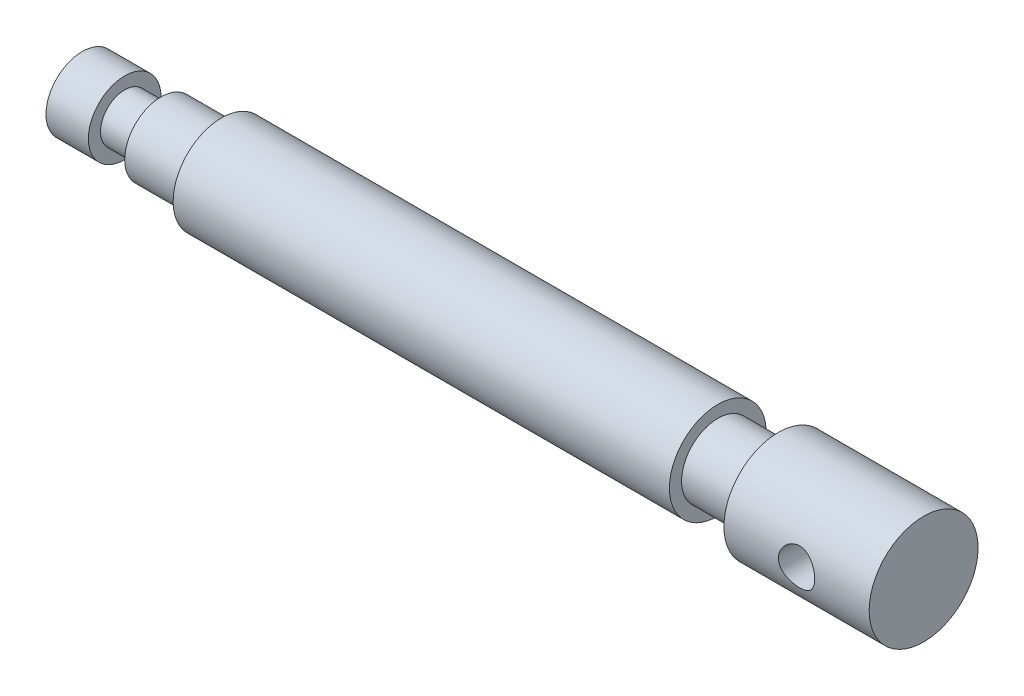
from build123d import *

# Parameters (mm, degrees)
CUT_EXTRUDE3_DEPTH      = 140.581517401
CUT_EXTRUDE3_DEPTH_BACK = 140.581517401
SKETCH2_R               = 3


with BuildPart() as part:
    # Sketch1 → Revolve1 (revolve)
    with BuildSketch(Plane.XY, mode=Mode.PRIVATE) as revolve1_sk:
        Polygon((0, 0), (0, 6), (7, 6), (7, 4), (13, 4), (13, 6), (23, 6), (23, 8), (105, 8), (105, 6), (115, 6), (115, 9), (139, 9), (139, 0), (124.407695479, 0), align=None)
    revolve(revolve1_sk.sketch.rotate(Axis((0, 0, 0), (1, 0, 0)), 90), axis=Axis((0, 0, 0), (1, 0, 0)))

    # Sketch2 → Cut-Extrude3 (cut, two sides: drawn at the far end of the back side and taken through both)
    with BuildSketch(Plane.XY.offset(-CUT_EXTRUDE3_DEPTH_BACK)):
        with Locations((127, 0)):
            Circle(SKETCH2_R)
    extrude(amount=CUT_EXTRUDE3_DEPTH + CUT_EXTRUDE3_DEPTH_BACK, mode=Mode.SUBTRACT)


solid = part.part
